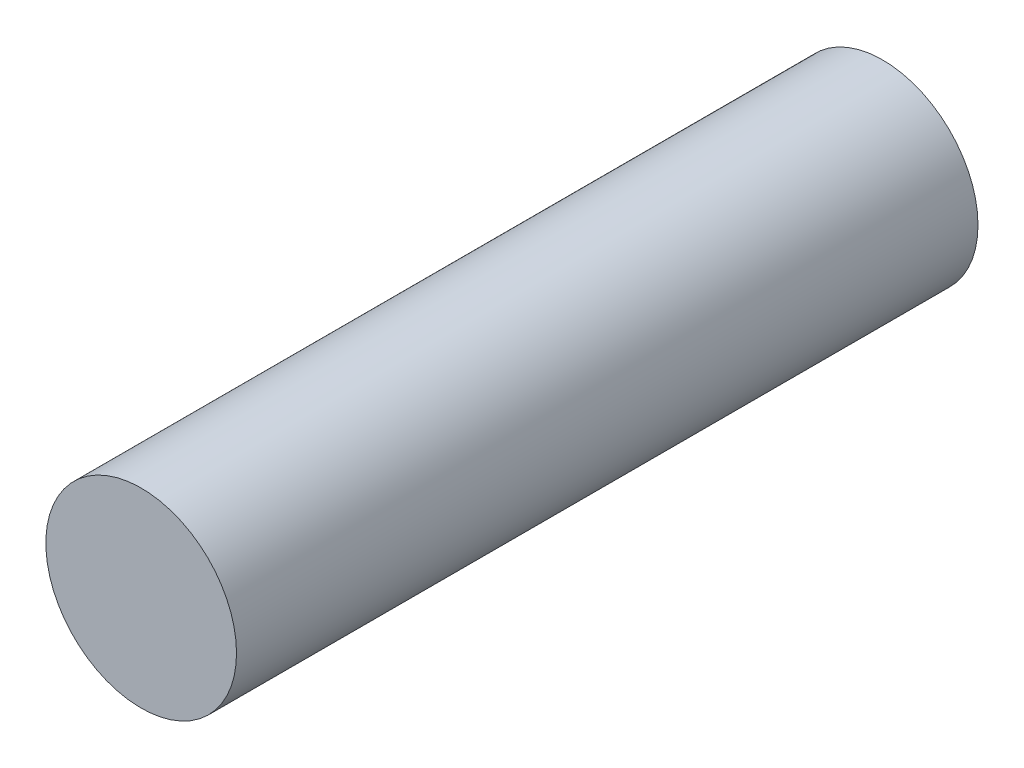
from build123d import *

# Parameters (mm, degrees)
SKETCH2_R           = 9
BOSS_EXTRUDE1_DEPTH = 70


with BuildPart() as part:
    # Sketch2 → Boss-Extrude1 (new body)
    with BuildSketch(Plane.XY):
        Circle(SKETCH2_R)
    extrude(amount=BOSS_EXTRUDE1_DEPTH)


solid = part.part
